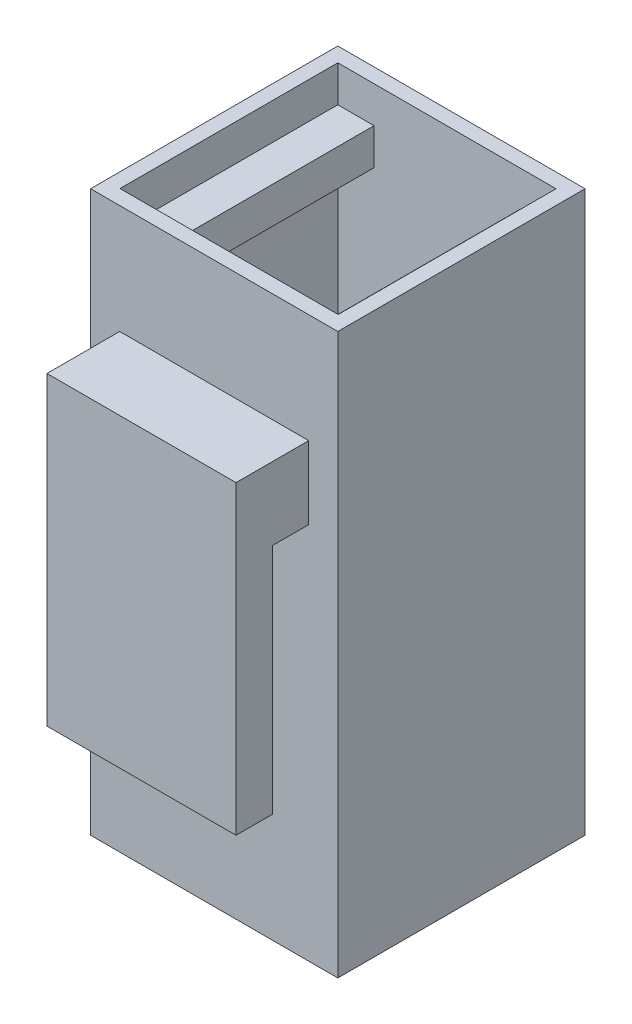
from build123d import *

# Parameters (mm, degrees)
SKETCH1_W           = 34
SKETCH1_H           = 34
SKETCH1_W_2         = 30
SKETCH1_H_2         = 30
BOSS_EXTRUDE1_DEPTH = 75
BOSS_EXTRUDE2_DEPTH = 10
CUT_EXTRUDE1_DEPTH  = 5
SKETCH7_W           = 34
SKETCH7_H           = 34
BOSS_EXTRUDE3_DEPTH = 2
SKETCH8_W           = 26
SKETCH8_H           = 42
BOSS_EXTRUDE4_DEPTH = 10
SKETCH9_W           = 5
SKETCH9_H           = 32.017862038
CUT_EXTRUDE2_DEPTH  = 28


with BuildPart() as part:
    # Sketch1 → Boss-Extrude1 (new body)
    with BuildSketch(Plane(origin=(0, 0, 0), x_dir=(1, 0, 0), z_dir=(0, 1, 0))):
        with Locations((15, -15)):
            Rectangle(SKETCH1_W, SKETCH1_H)
        with Locations((15, -15)):
            Rectangle(SKETCH1_W_2, SKETCH1_H_2, mode=Mode.SUBTRACT)
    extrude(amount=BOSS_EXTRUDE1_DEPTH)

    # Sketch3 → Boss-Extrude2 (add)
    with BuildSketch(Plane(origin=(0, 75, 0), x_dir=(1, 0, 0), z_dir=(0, 1, 0))):
        Polygon((0, 0), (4.981706014, 0), (4.981706014, -25), (24.981706014, -25), (24.981706014, 0), (30, 0), (30, -30), (0, -30), align=None)
    extrude(amount=-BOSS_EXTRUDE2_DEPTH)

    # Sketch4 → Cut-Extrude1 (cut)
    with BuildSketch(Plane(origin=(0, 75, 0), x_dir=(1, 0, 0), z_dir=(0, 1, 0))):
        Polygon((24.981706014, 0), (30.007946467, 0), (30.007946467, -29.950959986), (0, -29.950959986), (0, 0), (4.981706014, 0), (4.981706014, -25), (24.981706014, -25), align=None)
    extrude(amount=-CUT_EXTRUDE1_DEPTH, mode=Mode.SUBTRACT)

    # Sketch7 → Boss-Extrude3 (add)
    with BuildSketch(Plane.XZ):
        with Locations((15, 15)):
            Rectangle(SKETCH7_W, SKETCH7_H)
    extrude(amount=BOSS_EXTRUDE3_DEPTH)

    # Sketch8 → Boss-Extrude4 (add)
    with BuildSketch(Plane.XY.offset(32)):
        with Locations((15, 39)):
            Rectangle(SKETCH8_W, SKETCH8_H)
    extrude(amount=BOSS_EXTRUDE4_DEPTH)

    # Sketch9 → Cut-Extrude2 (cut)
    with BuildSketch(Plane.ZY.offset(-2)):
        with Locations((34.5, 33.991068981)):
            Rectangle(SKETCH9_W, SKETCH9_H)
    extrude(amount=-CUT_EXTRUDE2_DEPTH, mode=Mode.SUBTRACT)


solid = part.part
